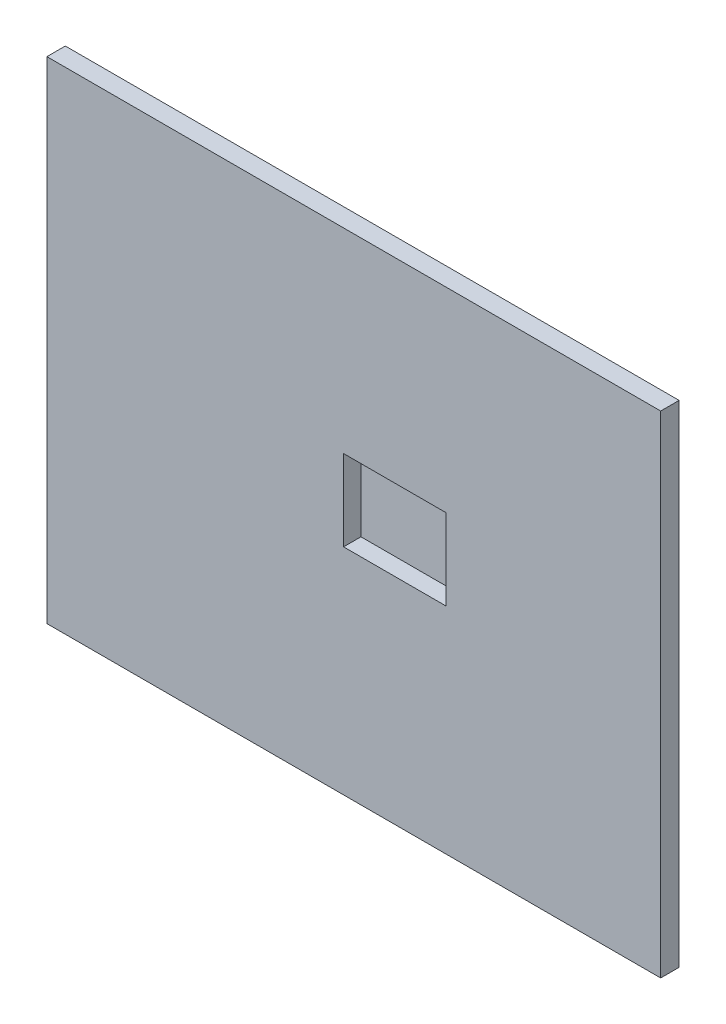
from build123d import *

# Parameters (mm, degrees)
ESQUISSE1_W             = 600
ESQUISSE1_H             = 480
BOSS_EXTRU_1_DEPTH      = 18
ESQUISSE2_W             = 100
ESQUISSE2_H             = 79
ENL_V_MAT_EXTRU_1_DEPTH = 17


with BuildPart() as part:
    # Esquisse1 → Boss.-Extru.1 (new body)
    with BuildSketch(Plane.XY):
        Rectangle(ESQUISSE1_W, ESQUISSE1_H)
    extrude(amount=BOSS_EXTRU_1_DEPTH)

    # Esquisse2 → Enlèv. mat.-Extru.1 (cut)
    with BuildSketch(Plane.XY.offset(18)):
        with Locations((40, 9.5)):
            Rectangle(ESQUISSE2_W, ESQUISSE2_H)
    extrude(amount=-ENL_V_MAT_EXTRU_1_DEPTH, mode=Mode.SUBTRACT)


solid = part.part
